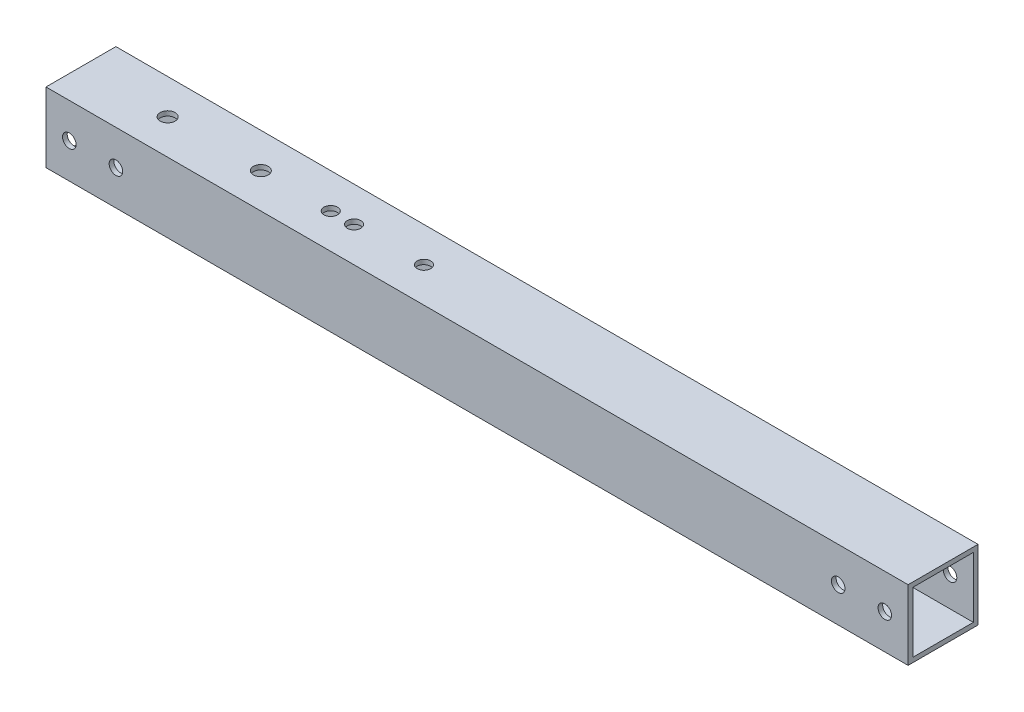
from build123d import *

# Parameters (mm, degrees)
SKETCH_1_W          = 15
SKETCH_1_H          = 15
SKETCH_1_W_2        = 13
SKETCH_1_H_2        = 13
EXTRUDE_1_DEPTH     = 185
SKETCH_2_R          = 1.45
CUT_EXTRUDE_1_DEPTH = 186.758579883
SKETCH_3_R          = 1.6
SKETCH_3_R_2        = 1.45
CUT_EXTRUDE_2_DEPTH = 186.758579883


with BuildPart() as part:
    # 草图1 → 凸台-拉伸1 (new body)
    with BuildSketch(Plane(origin=(0, 0, 0), x_dir=(0, 0, -1), z_dir=(1, 0, 0))):
        Rectangle(SKETCH_1_W, SKETCH_1_H)
        Rectangle(SKETCH_1_W_2, SKETCH_1_H_2, mode=Mode.SUBTRACT)
    extrude(amount=EXTRUDE_1_DEPTH)

    # 草图2 → 切除-拉伸1 (cut, through all)
    with BuildSketch(Plane.XY.offset(7.5)):
        with Locations((180, 0)):
            Circle(SKETCH_2_R)
        with Locations((170, 0)):
            Circle(SKETCH_2_R)
        with Locations((5, 0)):
            Circle(SKETCH_2_R)
        with Locations((15, 0)):
            Circle(SKETCH_2_R)
    extrude(amount=-CUT_EXTRUDE_1_DEPTH, mode=Mode.SUBTRACT)

    # 草图3 → 切除-拉伸2 (cut, through all)
    with BuildSketch(Plane(origin=(0, 7.5, 0), x_dir=(1, 0, 0), z_dir=(0, 1, 0))):
        with Locations(Location((38.6, 0, 0), (0, 0, 270))):
            Circle(SKETCH_3_R)
        with Locations(Location((18.6, 0, 0), (0, 0, 270))):
            Circle(SKETCH_3_R)
        with Locations(Location((53.6, 0, 0), (0, 0, 270))):
            Circle(SKETCH_3_R_2)
        with Locations(Location((58.6, 0, 0), (0, 0, 270))):
            Circle(SKETCH_3_R_2)
        with Locations(Location((73.6, 0, 0), (0, 0, 270))):
            Circle(SKETCH_3_R_2)
    extrude(amount=-CUT_EXTRUDE_2_DEPTH, mode=Mode.SUBTRACT)


solid = part.part
